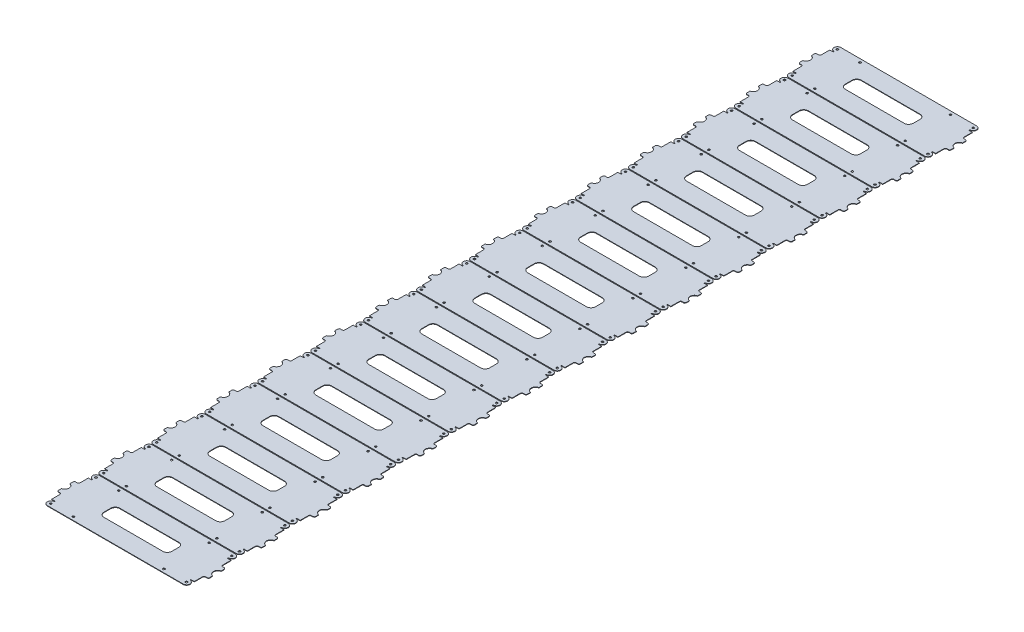
from build123d import *

# Parameters (mm, degrees)
SKETCH1_R           = 2.2
SKETCH1_W           = 150
SKETCH1_H           = 35
BOSS_EXTRUDE1_DEPTH = 1
FILLET1_R           = 10
FILLET2_R           = 3
LPATTERN1_COUNT     = 15
LPATTERN1_PITCH     = 117


with BuildPart() as part:
    # Sketch1 → Boss-Extrude1 (new body)
    with BuildSketch(Plane(origin=(0, 0, 0), x_dir=(1, 0, 0), z_dir=(0, 1, 0))):
        with BuildLine():
            Line((150, 57.5), (-150, 57.5))
            ThreePointArc((-150, 57.5), (-157.5, 50), (-150, 42.5))
            Line((-150, 42.5), (-150, 40.5))
            Line((-150, 40.5), (-157.5, 40.5))
            Line((-157.5, 40.5), (-157.5, 19))
            Line((-157.5, 19), (-167.025, 19))
            Line((-167.025, 19), (-167.025, 9.312659395))
            ThreePointArc((-167.025, 9.312659395), (-159.5, 0), (-167.025, -9.312659395))
            Line((-167.025, -9.312659395), (-167.025, -19))
            Line((-167.025, -19), (-157.5, -19))
            Line((-157.5, -19), (-157.5, -40.5))
            Line((-157.5, -40.5), (-150, -40.5))
            Line((-150, -40.5), (-150, -42.5))
            ThreePointArc((-150, -42.5), (-157.5, -50), (-150, -57.5))
            Line((-150, -57.5), (150, -57.5))
            ThreePointArc((150, -57.5), (157.5, -50), (150, -42.5))
            Line((150, -42.5), (150, -40.5))
            Line((150, -40.5), (157.5, -40.5))
            Line((157.5, -40.5), (157.5, -19))
            Line((157.5, -19), (167.025, -19))
            Line((167.025, -19), (167.025, -9.312659395))
            ThreePointArc((167.025, -9.312659395), (159.5, 0), (167.025, 9.312659395))
            Line((167.025, 9.312659395), (167.025, 19))
            Line((167.025, 19), (157.5, 19))
            Line((157.5, 19), (157.5, 40.5))
            Line((157.5, 40.5), (150, 40.5))
            Line((150, 40.5), (150, 42.5))
            ThreePointArc((150, 42.5), (157.5, 50), (150, 57.5))
        make_face()
        with Locations(Location((-150, 50, 0), (0, 0, 270))):
            Circle(SKETCH1_R, mode=Mode.SUBTRACT)
        with Locations(Location((150, 50, 0), (0, 0, 270))):
            Circle(SKETCH1_R, mode=Mode.SUBTRACT)
        with Locations(Location((150, -50, 0), (0, 0, 270))):
            Circle(SKETCH1_R, mode=Mode.SUBTRACT)
        with Locations(Location((-150, -50, 0), (0, 0, 270))):
            Circle(SKETCH1_R, mode=Mode.SUBTRACT)
        with Locations(Location((-100, 50, 0), (0, 0, 270))):
            Circle(SKETCH1_R, mode=Mode.SUBTRACT)
        with Locations(Location((100, 50, 0), (0, 0, 270))):
            Circle(SKETCH1_R, mode=Mode.SUBTRACT)
        with Locations(Location((100, -50, 0), (0, 0, 270))):
            Circle(SKETCH1_R, mode=Mode.SUBTRACT)
        with Locations(Location((-100, -50, 0), (0, 0, 270))):
            Circle(SKETCH1_R, mode=Mode.SUBTRACT)
        Rectangle(SKETCH1_W, SKETCH1_H, mode=Mode.SUBTRACT)
    extrude(amount=BOSS_EXTRUDE1_DEPTH)

    # Fillet1
    fillet1_edges = [part.edges().sort_by_distance(p)[0] for p in [
        (-75, 0.5, -17.5),
        (-75, 0.5, 17.5),
        (75, 0.5, 17.5),
        (75, 0.5, -17.5),
    ]]
    fillet(fillet1_edges, radius=FILLET1_R)

    # Fillet2
    fillet2_edges = [part.edges().sort_by_distance(p)[0] for p in [
        (-157.5, 0.5, 19),
        (-167.025, 0.5, 19),
        (-167.025, 0.5, -19),
        (-157.5, 0.5, -19),
        (157.5, 0.5, -19),
        (167.025, 0.5, -19),
        (167.025, 0.5, 19),
        (157.5, 0.5, 19),
    ]]
    fillet(fillet2_edges, radius=FILLET2_R)


with BuildPart() as lpattern1_1:
    # LPattern1: pattern copy
    add(part.part.moved(Location(Vector(0, 0, -1) * (1 * LPATTERN1_PITCH))))


with BuildPart() as lpattern1_2:
    # LPattern1: pattern copy
    add(part.part.moved(Location(Vector(0, 0, -1) * (2 * LPATTERN1_PITCH))))


with BuildPart() as lpattern1_3:
    # LPattern1: pattern copy
    add(part.part.moved(Location(Vector(0, 0, -1) * (3 * LPATTERN1_PITCH))))


with BuildPart() as lpattern1_4:
    # LPattern1: pattern copy
    add(part.part.moved(Location(Vector(0, 0, -1) * (4 * LPATTERN1_PITCH))))


with BuildPart() as lpattern1_5:
    # LPattern1: pattern copy
    add(part.part.moved(Location(Vector(0, 0, -1) * (5 * LPATTERN1_PITCH))))


with BuildPart() as lpattern1_6:
    # LPattern1: pattern copy
    add(part.part.moved(Location(Vector(0, 0, -1) * (6 * LPATTERN1_PITCH))))


with BuildPart() as lpattern1_7:
    # LPattern1: pattern copy
    add(part.part.moved(Location(Vector(0, 0, -1) * (7 * LPATTERN1_PITCH))))


with BuildPart() as lpattern1_8:
    # LPattern1: pattern copy
    add(part.part.moved(Location(Vector(0, 0, -1) * (8 * LPATTERN1_PITCH))))


with BuildPart() as lpattern1_9:
    # LPattern1: pattern copy
    add(part.part.moved(Location(Vector(0, 0, -1) * (9 * LPATTERN1_PITCH))))


with BuildPart() as lpattern1_10:
    # LPattern1: pattern copy
    add(part.part.moved(Location(Vector(0, 0, -1) * (10 * LPATTERN1_PITCH))))


with BuildPart() as lpattern1_11:
    # LPattern1: pattern copy
    add(part.part.moved(Location(Vector(0, 0, -1) * (11 * LPATTERN1_PITCH))))


with BuildPart() as lpattern1_12:
    # LPattern1: pattern copy
    add(part.part.moved(Location(Vector(0, 0, -1) * (12 * LPATTERN1_PITCH))))


with BuildPart() as lpattern1_13:
    # LPattern1: pattern copy
    add(part.part.moved(Location(Vector(0, 0, -1) * (13 * LPATTERN1_PITCH))))


with BuildPart() as lpattern1_14:
    # LPattern1: pattern copy
    add(part.part.moved(Location(Vector(0, 0, -1) * (14 * LPATTERN1_PITCH))))


solid = Compound([part.part, lpattern1_1.part, lpattern1_2.part, lpattern1_3.part, lpattern1_4.part, lpattern1_5.part, lpattern1_6.part, lpattern1_7.part, lpattern1_8.part, lpattern1_9.part, lpattern1_10.part, lpattern1_11.part, lpattern1_12.part, lpattern1_13.part, lpattern1_14.part])
